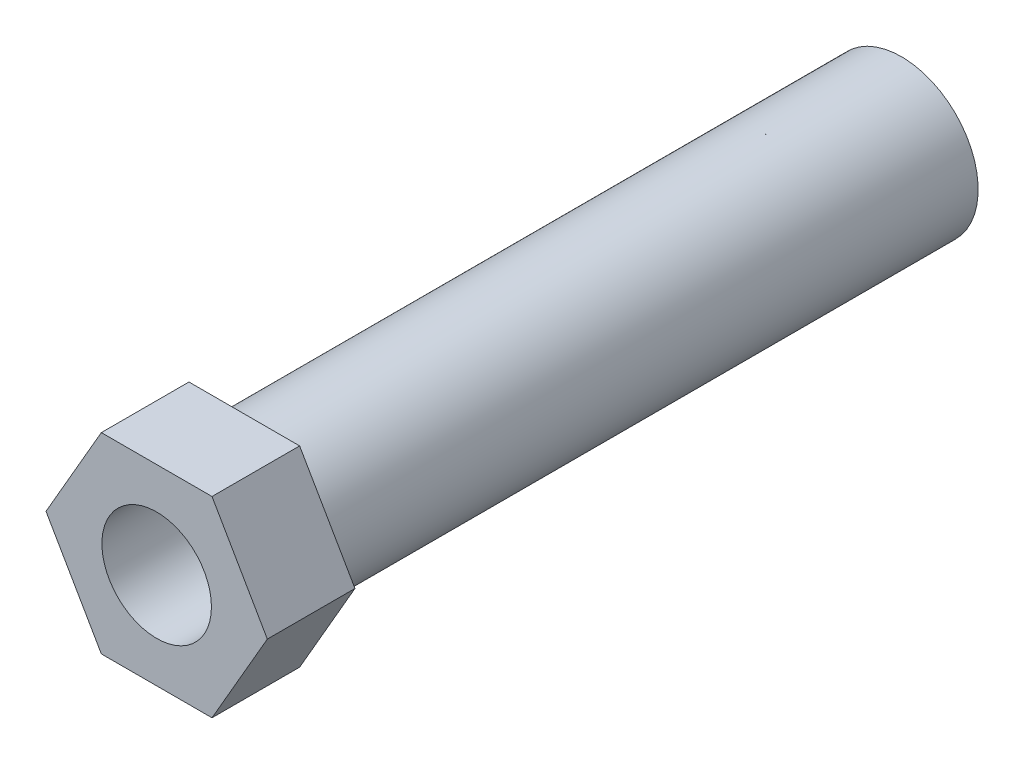
from build123d import *

# Parameters (mm, degrees)
EXTRUDE_1_DEPTH     = 4
SKETCH_2_R          = 3.5
SKETCH_2_R_2        = 2.5
EXTRUDE_2_DEPTH     = 30
SKETCH_3_R          = 2.5
CUT_EXTRUDE_1_DEPTH = 64


with BuildPart() as part:
    # 草图1 → 凸台-拉伸1 (new body)
    with BuildSketch(Plane.XY):
        Polygon((5.051814855, 0), (2.525907428, 4.375), (-2.525907428, 4.375), (-5.051814855, 0), (-2.525907428, -4.375), (2.525907428, -4.375), align=None)
    extrude(amount=EXTRUDE_1_DEPTH)

    # 草图2 → 凸台-拉伸2 (add)
    with BuildSketch(Plane(origin=(0, 0, 0), x_dir=(-1, 0, 0), z_dir=(0, 0, -1))):
        Circle(SKETCH_2_R)
        Circle(SKETCH_2_R_2, mode=Mode.SUBTRACT)
    extrude(amount=EXTRUDE_2_DEPTH)

    # 草图3 → 切除-拉伸1 (cut)
    with BuildSketch(Plane.XY.offset(4)):
        Circle(SKETCH_3_R)
    extrude(amount=-CUT_EXTRUDE_1_DEPTH, mode=Mode.SUBTRACT)


solid = part.part
